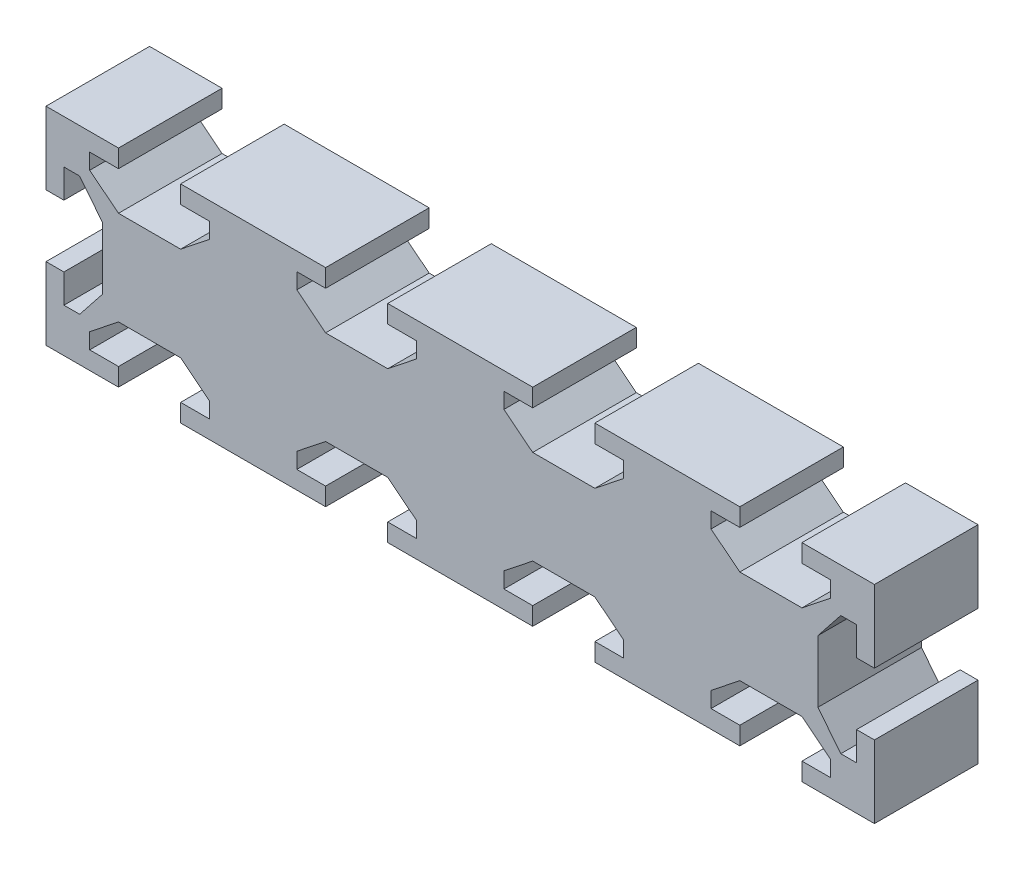
from build123d import *

# Parameters (mm, degrees)
BOSS_EXTRUDE1_DEPTH = 5


with BuildPart() as part:
    # Sketch1 → Boss-Extrude1 (new, symmetric)
    with BuildSketch(Plane.XY):
        Polygon((-10, 3), (-10, 10), (-3, 10), (-3, 8.27), (-5.78, 8.27), (-5.78, 6.75), (-3, 4.542263603), (3, 4.542263603), (5.78, 6.75), (5.78, 8.27), (3, 8.27), (3, 10), (10, 10), (17, 10), (17, 8.27), (14.22, 8.27), (14.22, 6.75), (17, 4.542263603), (23, 4.542263603), (25.78, 6.75), (25.78, 8.27), (23, 8.27), (23, 10), (30, 10), (37, 10), (37, 8.27), (34.22, 8.27), (34.22, 6.75), (37, 4.542263603), (43, 4.542263603), (45.78, 6.75), (45.78, 8.27), (43, 8.27), (43, 10), (50, 10), (57, 10), (57, 8.27), (54.22, 8.27), (54.22, 6.75), (57, 4.542263603), (63, 4.542263603), (65.78, 6.75), (65.78, 8.27), (63, 8.27), (63, 10), (70, 10), (70, 3), (68.27, 3), (68.27, 5.78), (66.75, 5.78), (64.542263603, 3), (64.542263603, -3), (66.75, -5.78), (68.27, -5.78), (68.27, -3), (70, -3), (70, -10), (63, -10), (63, -8.27), (65.78, -8.27), (65.78, -6.75), (63, -4.542263603), (57, -4.542263603), (54.22, -6.75), (54.22, -8.27), (57, -8.27), (57, -10), (50, -10), (43, -10), (43, -8.27), (45.78, -8.27), (45.78, -6.75), (43, -4.542263603), (37, -4.542263603), (34.22, -6.75), (34.22, -8.27), (37, -8.27), (37, -10), (30, -10), (23, -10), (23, -8.27), (25.78, -8.27), (25.78, -6.75), (23, -4.542263603), (17, -4.542263603), (14.22, -6.75), (14.22, -8.27), (17, -8.27), (17, -10), (10, -10), (3, -10), (3, -8.27), (5.78, -8.27), (5.78, -6.75), (3, -4.542263603), (-3, -4.542263603), (-5.78, -6.75), (-5.78, -8.27), (-3, -8.27), (-3, -10), (-10, -10), (-10, -3), (-8.27, -3), (-8.27, -5.78), (-6.75, -5.78), (-4.542263603, -3), (-4.542263603, 3), (-6.75, 5.78), (-8.27, 5.78), (-8.27, 3), align=None)
    extrude(amount=BOSS_EXTRUDE1_DEPTH, both=True)


solid = part.part
